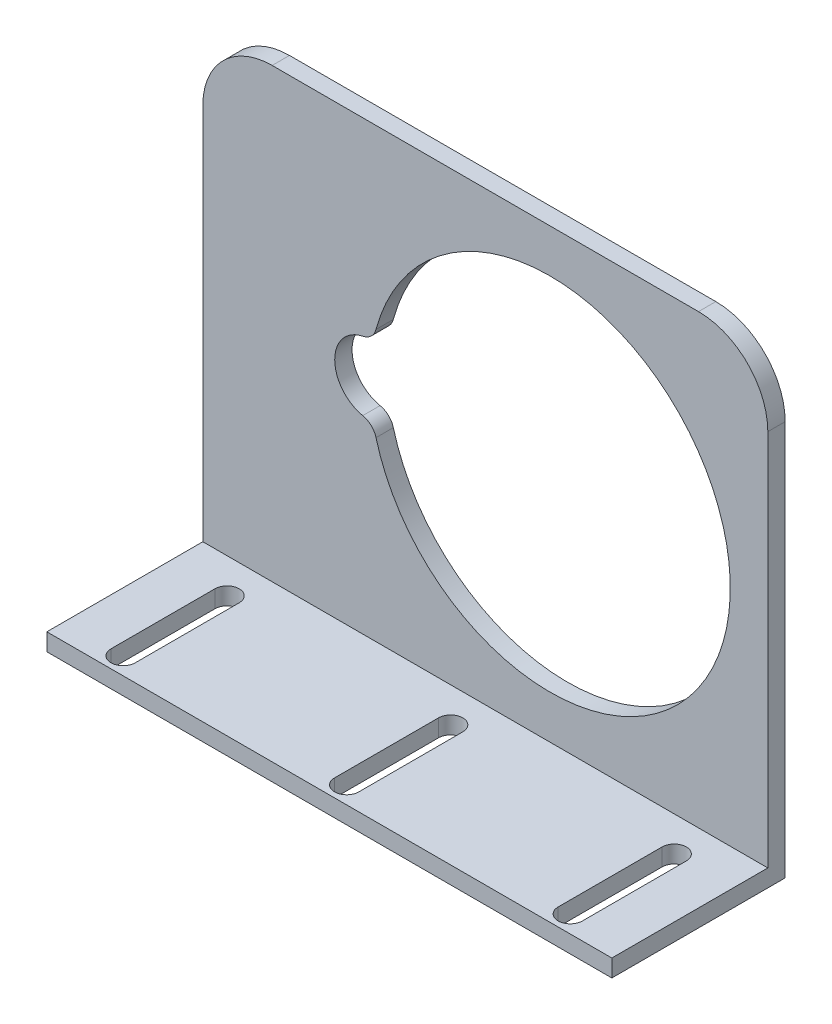
from build123d import *

# Parameters (mm, degrees)
SKETCH1_W           = 163
SKETCH1_H           = 50
BOSS_EXTRUDE1_DEPTH = 5
SKETCH6_W           = 163
SKETCH6_H           = 5
BOSS_EXTRUDE2_DEPTH = 129
CUT_EXTRUDE1_DEPTH  = 164.166326183
FILLET1_R           = 5
FILLET2_R           = 20
CUT_EXTRUDE2_DEPTH  = 155.622928594
CUT_EXTRUDE3_DEPTH  = 155.622928594


with BuildPart() as part:
    # Sketch1 → Boss-Extrude1 (new body)
    with BuildSketch(Plane(origin=(0, 0, 0), x_dir=(1, 0, 0), z_dir=(0, 1, 0))):
        Rectangle(SKETCH1_W, SKETCH1_H)
    extrude(amount=BOSS_EXTRUDE1_DEPTH)

    # Sketch6 → Boss-Extrude2 (add)
    with BuildSketch(Plane(origin=(0, 5, 0), x_dir=(1, 0, 0), z_dir=(0, 1, 0))):
        with Locations((0, 22.5)):
            Rectangle(SKETCH6_W, SKETCH6_H)
    extrude(amount=BOSS_EXTRUDE2_DEPTH)

    # Sketch7 → Cut-Extrude1 (cut, through all)
    with BuildSketch(Plane.XY.offset(-20)):
        with BuildLine():
            ThreePointArc((-32.33968901, 59.421555555), (70.67427925, 69.5), (-32.33968901, 79.578444445))
            ThreePointArc((-32.33968901, 79.578444445), (-43.452284877, 69.5), (-32.33968901, 59.421555555))
        make_face()
    extrude(amount=-CUT_EXTRUDE1_DEPTH, mode=Mode.SUBTRACT)

    # Fillet1
    fillet1_edges = [part.edges().sort_by_distance(p)[0] for p in [
        (-32.33968901, 59.421555555, -22.5),
        (-32.33968901, 79.578444445, -22.5),
    ]]
    fillet(fillet1_edges, radius=FILLET1_R)

    # Fillet2
    fillet2_edges = [part.edges().sort_by_distance(p)[0] for p in [
        (-81.5, 134, -22.5),
        (81.5, 134, -22.5),
    ]]
    fillet(fillet2_edges, radius=FILLET2_R)

    # Sketch9 → Cut-Extrude2 (cut, through all)
    with BuildSketch(Plane(origin=(0, 5, 0), x_dir=(1, 0, 0), z_dir=(0, 1, 0))):
        with BuildLine():
            Line((-61, 10), (-61, -20))
            ThreePointArc((-61, -20), (-64.5, -23.5), (-68, -20))
            Line((-68, -20), (-68, 10))
            ThreePointArc((-68, 10), (-64.5, 13.5), (-61, 10))
        make_face()
    cut_extrude2 = extrude(amount=-CUT_EXTRUDE2_DEPTH, mode=Mode.SUBTRACT)

    # Mirror3: Cut-Extrude2 across plane
    add(cut_extrude2.mirror(Plane(origin=(0, 0, 0), x_dir=(0, 0, 1), z_dir=(1, 0, 0))), mode=Mode.SUBTRACT)

    # Sketch10 → Cut-Extrude3 (cut, through all)
    with BuildSketch(Plane(origin=(0, 5, 0), x_dir=(1, 0, 0), z_dir=(0, 1, 0))):
        with BuildLine():
            Line((3.5, 10), (3.5, -20))
            ThreePointArc((3.5, -20), (0, -23.5), (-3.5, -20))
            Line((-3.5, -20), (-3.5, 10))
            ThreePointArc((-3.5, 10), (0, 13.5), (3.5, 10))
        make_face()
    extrude(amount=-CUT_EXTRUDE3_DEPTH, mode=Mode.SUBTRACT)


solid = part.part
